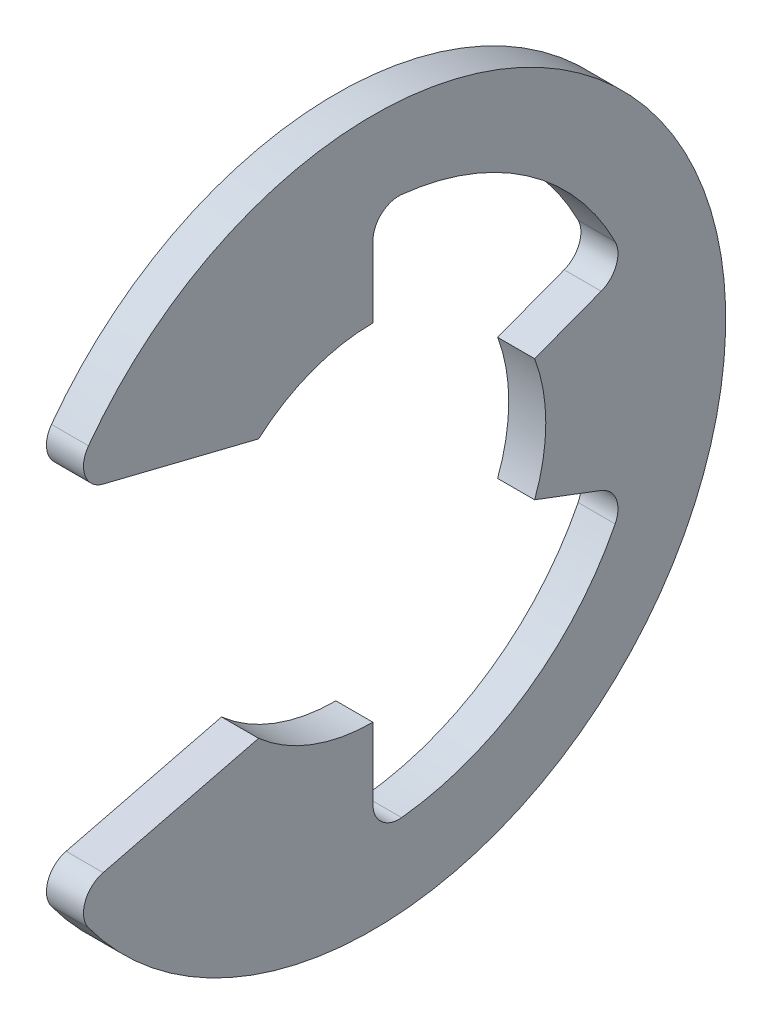
from build123d import *

# Parameters (mm, degrees)
EXTRUDE1_DEPTH = 0.5334
FILLET1_R      = 0.74676


with BuildPart() as part:
    # Sketch1 → Extrude1 (new, symmetric)
    with BuildSketch(Plane(origin=(0, 0, 0), x_dir=(0, 0, -1), z_dir=(1, 0, 0))):
        with BuildLine():
            Line((-8.788323021, -5.098134804), (-3.292902082, -3.7338))
            ThreePointArc((-3.292902082, -3.7338), (-1.7601302, -4.656866784), (0, -4.9784))
            Line((0, -4.9784), (0, -7.813367742))
            ThreePointArc((0, -7.813367742), (4.442112961, -6.427779392), (7.308736282, -2.762442657))
            Line((7.308736282, -2.762442657), (4.656866784, -1.7601302))
            ThreePointArc((4.656866784, -1.7601302), (4.9784, 0), (4.656866784, 1.7601302))
            Line((4.656866784, 1.7601302), (7.308736282, 2.762442657))
            ThreePointArc((7.308736282, 2.762442657), (4.442112961, 6.427779392), (0, 7.813367742))
            Line((0, 7.813367742), (0, 4.9784))
            ThreePointArc((0, 4.9784), (-1.7601302, 4.656866784), (-3.292902082, 3.7338))
            Line((-3.292902082, 3.7338), (-8.788323021, 5.098134804))
            ThreePointArc((-8.788323021, 5.098134804), (10.16, 0), (-8.788323021, -5.098134804))
        make_face()
    extrude(amount=EXTRUDE1_DEPTH, both=True)

    # Fillet1
    fillet1_edges = [part.edges().sort_by_distance(p)[0] for p in [
        (0, -5.098134804, 8.788323021),
        (0, -7.813367742, 0),
        (0, -2.762442657, -7.308736282),
        (0, 2.762442657, -7.308736282),
        (0, 7.813367742, 0),
        (0, 5.098134804, 8.788323021),
    ]]
    fillet(fillet1_edges, radius=FILLET1_R)


solid = part.part
